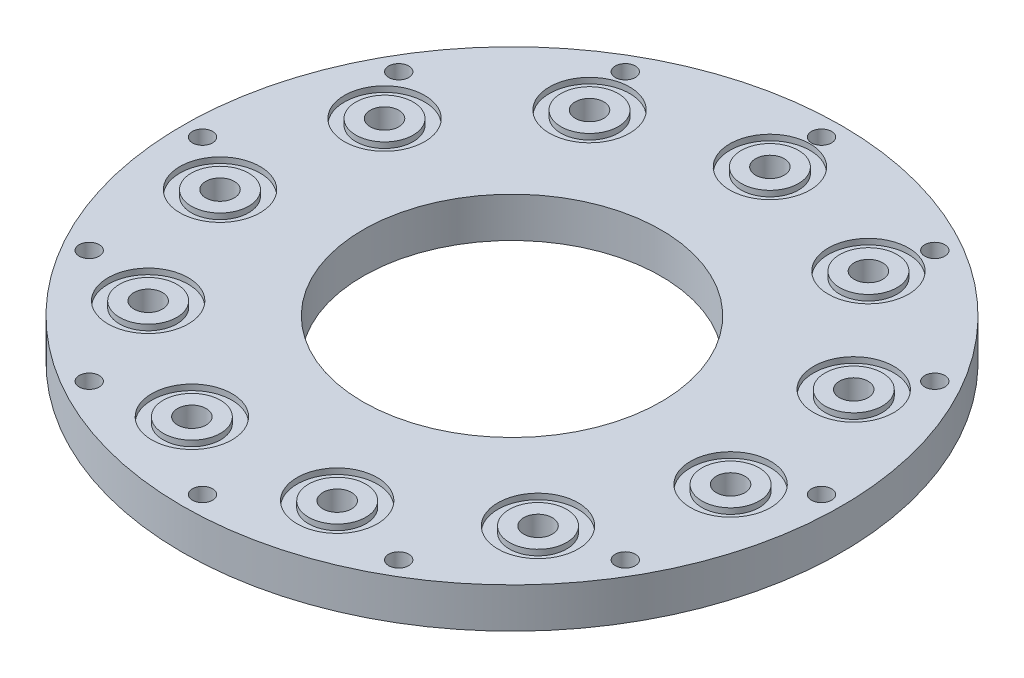
from build123d import *

# Parameters (mm, degrees)
SKETCH1_R           = 57.5
SKETCH1_R_2         = 1.75
SKETCH1_R_3         = 26
SKETCH1_R_4         = 2.5
BOSS_EXTRUDE1_DEPTH = 7
SKETCH2_R           = 7
SKETCH2_R_2         = 5
CUT_EXTRUDE1_DEPTH  = 1


with BuildPart() as part:
    # Sketch1 → Boss-Extrude1 (new body)
    with BuildSketch(Plane(origin=(0, 0, 0), x_dir=(1, 0, 0), z_dir=(0, 1, 0))):
        with Locations(Location((0, 0, 0), (0, 0, 270))):
            Circle(SKETCH1_R)
        with Locations(Location((0, 54, 0), (0, 0, 270))):
            Circle(SKETCH1_R_2, mode=Mode.SUBTRACT)
        with Locations(Location((27, 46.765371804, 0), (0, 0, 270))):
            Circle(SKETCH1_R_2, mode=Mode.SUBTRACT)
        with Locations(Location((46.765371804, 27, 0), (0, 0, 270))):
            Circle(SKETCH1_R_2, mode=Mode.SUBTRACT)
        with Locations(Location((54, 0, 0), (0, 0, 270))):
            Circle(SKETCH1_R_2, mode=Mode.SUBTRACT)
        with Locations(Location((46.765371804, -27, 0), (0, 0, 270))):
            Circle(SKETCH1_R_2, mode=Mode.SUBTRACT)
        with Locations(Location((27, -46.765371804, 0), (0, 0, 270))):
            Circle(SKETCH1_R_2, mode=Mode.SUBTRACT)
        with Locations(Location((0, -54, 0), (0, 0, 270))):
            Circle(SKETCH1_R_2, mode=Mode.SUBTRACT)
        with Locations(Location((-27, -46.765371804, 0), (0, 0, 270))):
            Circle(SKETCH1_R_2, mode=Mode.SUBTRACT)
        with Locations(Location((-46.765371804, -27, 0), (0, 0, 270))):
            Circle(SKETCH1_R_2, mode=Mode.SUBTRACT)
        with Locations(Location((-54, 0, 0), (0, 0, 270))):
            Circle(SKETCH1_R_2, mode=Mode.SUBTRACT)
        with Locations(Location((-46.765371804, 27, 0), (0, 0, 270))):
            Circle(SKETCH1_R_2, mode=Mode.SUBTRACT)
        with Locations(Location((-27, 46.765371804, 0), (0, 0, 270))):
            Circle(SKETCH1_R_2, mode=Mode.SUBTRACT)
        with Locations(Location((0, 0, 0), (0, 0, 270))):
            Circle(SKETCH1_R_3, mode=Mode.SUBTRACT)
        with Locations(Location((0, 45, 0), (0, 0, 270))):
            Circle(SKETCH1_R_4, mode=Mode.SUBTRACT)
        with Locations(Location((24.328836786, 37.856408977, 0), (0, 0, 270))):
            Circle(SKETCH1_R_4, mode=Mode.SUBTRACT)
        with Locations(Location((40.933439791, 18.693675585, 0), (0, 0, 270))):
            Circle(SKETCH1_R_4, mode=Mode.SUBTRACT)
        with Locations(Location((44.541964885, -6.404167722, 0), (0, 0, 270))):
            Circle(SKETCH1_R_4, mode=Mode.SUBTRACT)
        with Locations(Location((34.008730846, -29.468733028, 0), (0, 0, 270))):
            Circle(SKETCH1_R_4, mode=Mode.SUBTRACT)
        with Locations(Location((12.677965058, -43.177183813, 0), (0, 0, 270))):
            Circle(SKETCH1_R_4, mode=Mode.SUBTRACT)
        with Locations(Location((-12.677965058, -43.177183813, 0), (0, 0, 270))):
            Circle(SKETCH1_R_4, mode=Mode.SUBTRACT)
        with Locations(Location((-34.008730846, -29.468733028, 0), (0, 0, 270))):
            Circle(SKETCH1_R_4, mode=Mode.SUBTRACT)
        with Locations(Location((-44.541964885, -6.404167722, 0), (0, 0, 270))):
            Circle(SKETCH1_R_4, mode=Mode.SUBTRACT)
        with Locations(Location((-40.933439791, 18.693675585, 0), (0, 0, 270))):
            Circle(SKETCH1_R_4, mode=Mode.SUBTRACT)
        with Locations(Location((-24.328836786, 37.856408977, 0), (0, 0, 270))):
            Circle(SKETCH1_R_4, mode=Mode.SUBTRACT)
    extrude(amount=BOSS_EXTRUDE1_DEPTH)

    # Sketch2 → Cut-Extrude1 (cut)
    # profile 1 of 11: a face of its own
    with BuildSketch(Plane(origin=(0, 7, 0), x_dir=(1, 0, 0), z_dir=(0, 1, 0))):
        with Locations(Location((0, 45, 0), (0, 0, 270))):
            Circle(SKETCH2_R)
        with Locations(Location((0, 45, 0), (0, 0, 270))):
            Circle(SKETCH2_R_2, mode=Mode.SUBTRACT)
    # profile 2 of 11: a face of its own
    with BuildSketch(Plane(origin=(0, 7, 0), x_dir=(1, 0, 0), z_dir=(0, 1, 0))):
        with Locations(Location((24.328836786, 37.856408977, 0), (0, 0, 270))):
            Circle(SKETCH2_R)
        with Locations(Location((24.328836786, 37.856408977, 0), (0, 0, 270))):
            Circle(SKETCH2_R_2, mode=Mode.SUBTRACT)
    # profile 3 of 11: a face of its own
    with BuildSketch(Plane(origin=(0, 7, 0), x_dir=(1, 0, 0), z_dir=(0, 1, 0))):
        with Locations(Location((40.933439791, 18.693675585, 0), (0, 0, 270))):
            Circle(SKETCH2_R)
        with Locations(Location((40.933439791, 18.693675585, 0), (0, 0, 270))):
            Circle(SKETCH2_R_2, mode=Mode.SUBTRACT)
    # profile 4 of 11: a face of its own
    with BuildSketch(Plane(origin=(0, 7, 0), x_dir=(1, 0, 0), z_dir=(0, 1, 0))):
        with Locations(Location((44.541964885, -6.404167722, 0), (0, 0, 270))):
            Circle(SKETCH2_R)
        with Locations(Location((44.541964885, -6.404167722, 0), (0, 0, 270))):
            Circle(SKETCH2_R_2, mode=Mode.SUBTRACT)
    # profile 5 of 11: a face of its own
    with BuildSketch(Plane(origin=(0, 7, 0), x_dir=(1, 0, 0), z_dir=(0, 1, 0))):
        with Locations(Location((34.008730846, -29.468733028, 0), (0, 0, 270))):
            Circle(SKETCH2_R)
        with Locations(Location((34.008730846, -29.468733028, 0), (0, 0, 270))):
            Circle(SKETCH2_R_2, mode=Mode.SUBTRACT)
    # profile 6 of 11: a face of its own
    with BuildSketch(Plane(origin=(0, 7, 0), x_dir=(1, 0, 0), z_dir=(0, 1, 0))):
        with Locations(Location((12.677965058, -43.177183813, 0), (0, 0, 270))):
            Circle(SKETCH2_R)
        with Locations(Location((12.677965058, -43.177183813, 0), (0, 0, 270))):
            Circle(SKETCH2_R_2, mode=Mode.SUBTRACT)
    # profile 7 of 11: a face of its own
    with BuildSketch(Plane(origin=(0, 7, 0), x_dir=(1, 0, 0), z_dir=(0, 1, 0))):
        with Locations(Location((-12.677965058, -43.177183813, 0), (0, 0, 270))):
            Circle(SKETCH2_R)
        with Locations(Location((-12.677965058, -43.177183813, 0), (0, 0, 270))):
            Circle(SKETCH2_R_2, mode=Mode.SUBTRACT)
    # profile 8 of 11: a face of its own
    with BuildSketch(Plane(origin=(0, 7, 0), x_dir=(1, 0, 0), z_dir=(0, 1, 0))):
        with Locations(Location((-34.008730846, -29.468733028, 0), (0, 0, 270))):
            Circle(SKETCH2_R)
        with Locations(Location((-34.008730846, -29.468733028, 0), (0, 0, 270))):
            Circle(SKETCH2_R_2, mode=Mode.SUBTRACT)
    # profile 9 of 11: a face of its own
    with BuildSketch(Plane(origin=(0, 7, 0), x_dir=(1, 0, 0), z_dir=(0, 1, 0))):
        with Locations(Location((-44.541964885, -6.404167722, 0), (0, 0, 270))):
            Circle(SKETCH2_R)
        with Locations(Location((-44.541964885, -6.404167722, 0), (0, 0, 270))):
            Circle(SKETCH2_R_2, mode=Mode.SUBTRACT)
    # profile 10 of 11: a face of its own
    with BuildSketch(Plane(origin=(0, 7, 0), x_dir=(1, 0, 0), z_dir=(0, 1, 0))):
        with Locations(Location((-40.933439791, 18.693675585, 0), (0, 0, 270))):
            Circle(SKETCH2_R)
        with Locations(Location((-40.933439791, 18.693675585, 0), (0, 0, 270))):
            Circle(SKETCH2_R_2, mode=Mode.SUBTRACT)
    # profile 11 of 11: a face of its own
    with BuildSketch(Plane(origin=(0, 7, 0), x_dir=(1, 0, 0), z_dir=(0, 1, 0))):
        with Locations(Location((-24.328836786, 37.856408977, 0), (0, 0, 270))):
            Circle(SKETCH2_R)
        with Locations(Location((-24.328836786, 37.856408977, 0), (0, 0, 270))):
            Circle(SKETCH2_R_2, mode=Mode.SUBTRACT)
    extrude(amount=-CUT_EXTRUDE1_DEPTH, mode=Mode.SUBTRACT)


solid = part.part
